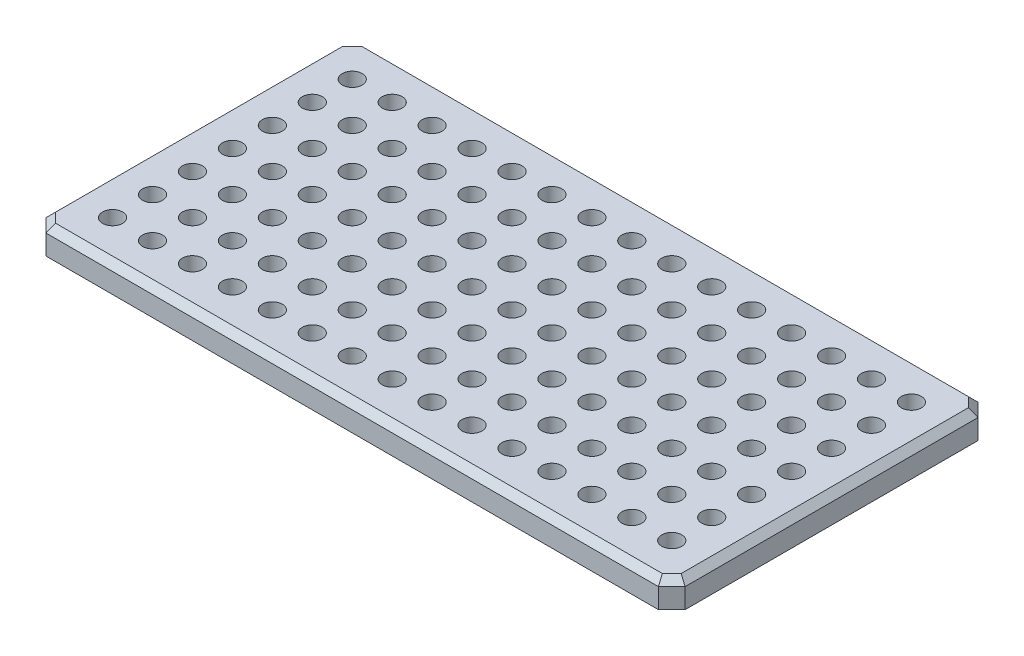
from build123d import *

# Parameters (mm, degrees)
SKETCH1_W            = 609.6
SKETCH1_H            = 304.8
BOSS_EXTRUDE1_DEPTH  = 25.4
CHAMFER1_SIZE        = 12.7
CHAMFER2_SIZE        = 6.35
SKETCH2_R            = 9.525
CUT_EXTRUDE1_DEPTH   = 342.722050796
LPATTERN1_COUNT      = 15
LPATTERN1_PITCH      = 38.1
LPATTERN1_COUNT_DIR2 = 7
LPATTERN1_PITCH_DIR2 = 38.1


with BuildPart() as part:
    # Sketch1 → Boss-Extrude1 (new body)
    with BuildSketch(Plane(origin=(0, 0, 0), x_dir=(1, 0, 0), z_dir=(0, 1, 0))):
        Rectangle(SKETCH1_W, SKETCH1_H)
    extrude(amount=BOSS_EXTRUDE1_DEPTH)

    # Chamfer1
    chamfer1_edges = [part.edges().sort_by_distance(p)[0] for p in [
        (-304.8, 12.7, -152.4),
        (304.8, 12.7, -152.4),
        (304.8, 12.7, 152.4),
        (-304.8, 12.7, 152.4),
    ]]
    chamfer(chamfer1_edges, length=CHAMFER1_SIZE)

    # Chamfer2
    chamfer2_edges = [part.edges().sort_by_distance(p)[0] for p in [
        (304.8, 25.4, 0),
        (0, 25.4, 152.4),
        (-304.8, 25.4, 0),
        (0, 25.4, -152.4),
        (-298.45, 25.4, -146.05),
        (-298.45, 25.4, 146.05),
        (298.45, 25.4, -146.05),
        (298.45, 25.4, 146.05),
    ]]
    chamfer(chamfer2_edges, length=CHAMFER2_SIZE)

    # Sketch2 → Cut-Extrude1 (cut, through all)
    with BuildSketch(Plane(origin=(0, 25.4, 0), x_dir=(1, 0, 0), z_dir=(0, 1, 0))):
        with Locations(Location((-266.7, 114.3, 0), (0, 0, 270))):
            Circle(SKETCH2_R)
    cut_extrude1 = extrude(amount=-CUT_EXTRUDE1_DEPTH, mode=Mode.SUBTRACT)

    # LPattern1: Cut-Extrude1 15 × 7
    with Locations(*[(i * LPATTERN1_PITCH, 0, j * LPATTERN1_PITCH_DIR2) for i in range(LPATTERN1_COUNT) for j in range(LPATTERN1_COUNT_DIR2) if (i, j) != (0, 0)]):
        add(cut_extrude1, mode=Mode.SUBTRACT)


solid = part.part
